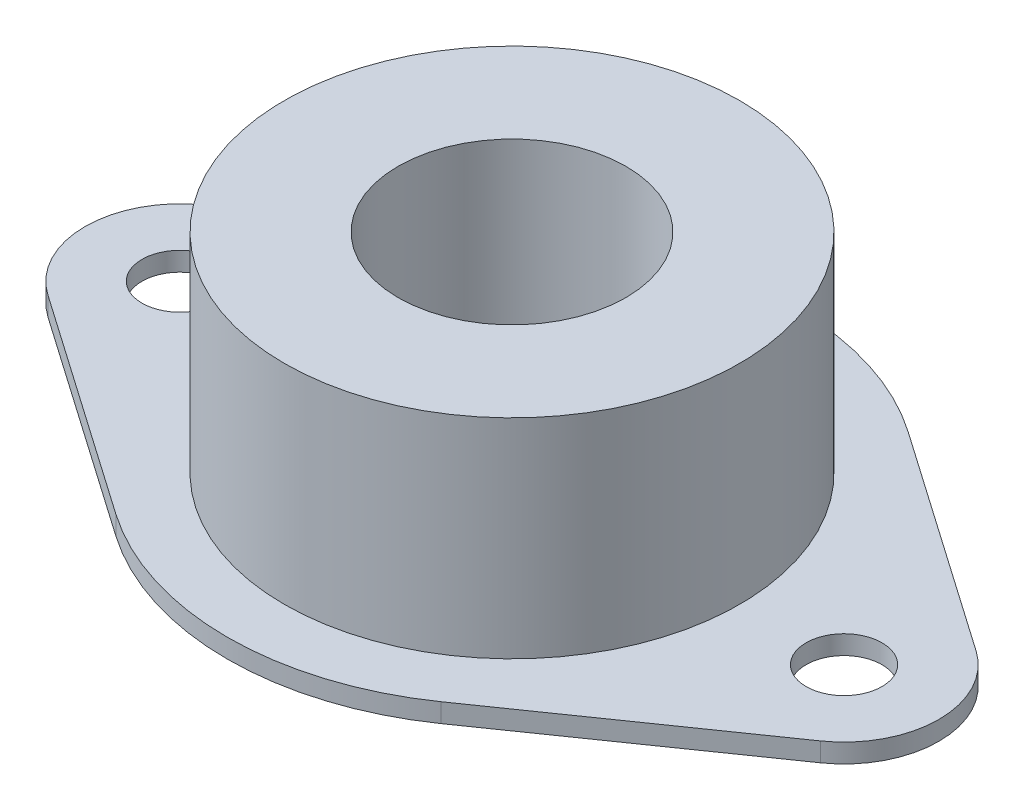
from build123d import *

# Parameters (mm, degrees)
SKETCH_1_R      = 2
EXTRUDE_1_DEPTH = 1
SKETCH_1_3_R    = 12
SKETCH_1_3_R_2  = 6
EXTRUDE_2_DEPTH = 12


with BuildPart() as part:
    # 草图1 → 凸台-拉伸1 (new body)
    with BuildSketch(Plane(origin=(0, 0, 0), x_dir=(1, 0, 0), z_dir=(0, 1, 0))):
        with BuildLine():
            ThreePointArc((-8.571428571, -12.3097771), (0, -15), (8.571428571, -12.3097771))
            Line((8.571428571, -12.3097771), (20.357142857, -4.103259033))
            ThreePointArc((20.357142857, -4.103259033), (22.5, 0), (20.357142857, 4.103259033))
            Line((20.357142857, 4.103259033), (8.571428571, 12.3097771))
            ThreePointArc((8.571428571, 12.3097771), (0, 15), (-8.571428571, 12.3097771))
            Line((-8.571428571, 12.3097771), (-20.357142857, 4.103259033))
            ThreePointArc((-20.357142857, 4.103259033), (-22.5, 0), (-20.357142857, -4.103259033))
            Line((-20.357142857, -4.103259033), (-8.571428571, -12.3097771))
        make_face()
        with Locations((17.5, 0)):
            Circle(SKETCH_1_R, mode=Mode.SUBTRACT)
        with Locations((-17.5, 0)):
            Circle(SKETCH_1_R, mode=Mode.SUBTRACT)
    extrude(amount=EXTRUDE_1_DEPTH)

    # 草图1<3> → 凸台-拉伸2 (add)
    with BuildSketch(Plane(origin=(0, 0, 0), x_dir=(1, 0, 0), z_dir=(0, 1, 0))):
        Circle(SKETCH_1_3_R)
        Circle(SKETCH_1_3_R_2, mode=Mode.SUBTRACT)
    extrude(amount=EXTRUDE_2_DEPTH)


solid = part.part
